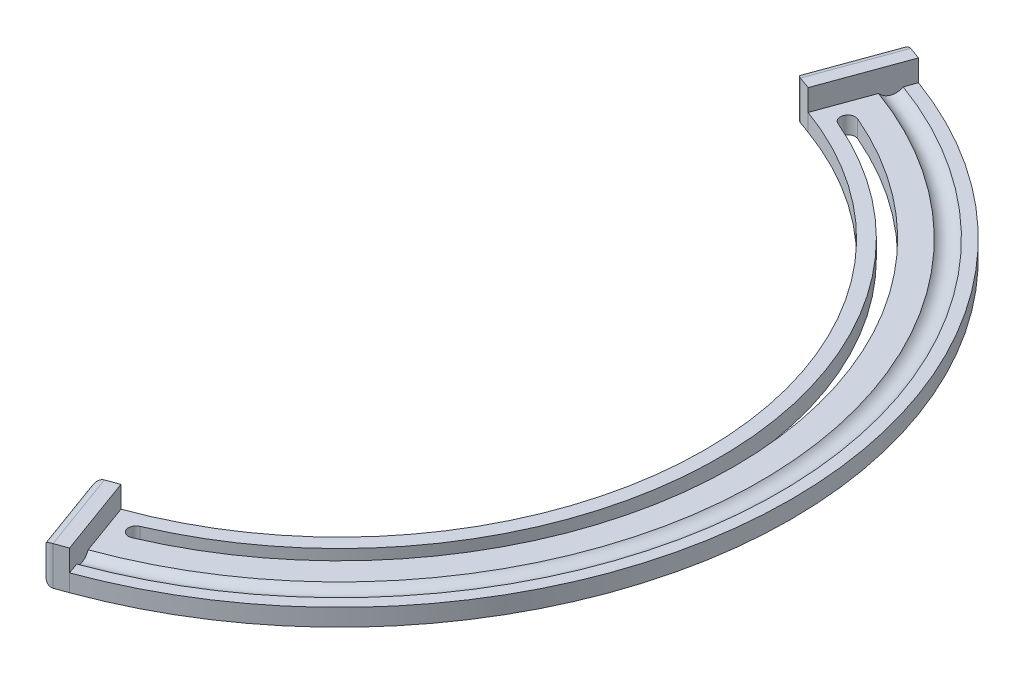
from build123d import *

# Parameters (mm, degrees)
REVOLVE_1_ANGLE     = 140
SKETCH_3_W          = 20
SKETCH_3_H          = 9
EXTRUDE_1_DEPTH     = 5
SKETCH_4_W          = 20
SKETCH_4_H          = 9
EXTRUDE_2_DEPTH     = 5
CUT_EXTRUDE_1_DEPTH = 5
FILLET_1_R          = 2


with BuildPart() as part:
    # 草图2 → 旋转1 (revolve, symmetric)
    with BuildSketch(Plane.XY) as revolve_1_sk:
        with BuildLine():
            ThreePointArc((102.236067977, -6), (100, -7), (97.763932023, -6))
            Line((97.763932023, -6), (85, -6))
            Line((85, -6), (85, -10))
            Line((85, -10), (105, -10))
            Line((105, -10), (105, -6))
            Line((105, -6), (102.236067977, -6))
        make_face()
    revolve(axis=Axis((0, 24.366902053, 0), (0, -1, 0)), revolution_arc=REVOLVE_1_ANGLE / 2)
    revolve(revolve_1_sk.sketch, axis=Axis((0, 24.366902053, 0), (0, 1, 0)), revolution_arc=REVOLVE_1_ANGLE / 2)

    # 草图3 → 凸台-拉伸1 (add)
    with BuildSketch(Plane(origin=(0, 0, 0), x_dir=(0.34202014332566616, 0, 0.9396926207859094), z_dir=(-0.9396926207859093, 0, 0.3420201433256661))):
        with Locations((95, -5.5)):
            Rectangle(SKETCH_3_W, SKETCH_3_H)
    extrude(amount=EXTRUDE_1_DEPTH)

    # 草图4 → 凸台-拉伸2 (add)
    with BuildSketch(Plane(origin=(0, 0, 0), x_dir=(-0.34202014332566616, 0, 0.9396926207859094), z_dir=(-0.9396926207859094, 0, -0.34202014332566616))):
        with Locations((-95, -5.5)):
            Rectangle(SKETCH_4_W, SKETCH_4_H)
    extrude(amount=EXTRUDE_2_DEPTH)

    # 草图5 → 切除-拉伸1 (cut)
    with BuildSketch(Plane(origin=(0, -6, 0), x_dir=(1, 0, 0), z_dir=(0, 1, 0))):
        with BuildLine():
            ThreePointArc((34.743766956, 81.122950869), (88.25, -6.1e-08), (34.743766843, -81.122950917))
            ThreePointArc((34.743766843, -81.122950917), (33.82406612, -83.420591403), (36.121706789, -84.340291668))
            ThreePointArc((36.121706789, -84.340291668), (91.75, 4e-08), (36.121706715, 84.3402917))
            ThreePointArc((36.121706715, 84.3402917), (33.82406608, 83.42059131), (34.743766956, 81.122950869))
        make_face()
    extrude(amount=-CUT_EXTRUDE_1_DEPTH, mode=Mode.SUBTRACT)

    # 圆角1
    fillet_1_edges = [part.edges().sort_by_distance(p)[0] for p in [
        (24.373249079, -5.5, 81.583973483),
        (31.213651945, -5.5, 100.377825899),
        (27.793450512, -1, 90.980899691),
        (27.793450512, -10, 90.980899691),
        (31.213651945, -5.5, -100.377825899),
        (24.373249079, -5.5, -81.583973483),
        (27.793450512, -1, -90.980899691),
        (27.793450512, -10, -90.980899691),
    ]]
    fillet(fillet_1_edges, radius=FILLET_1_R)


solid = part.part
